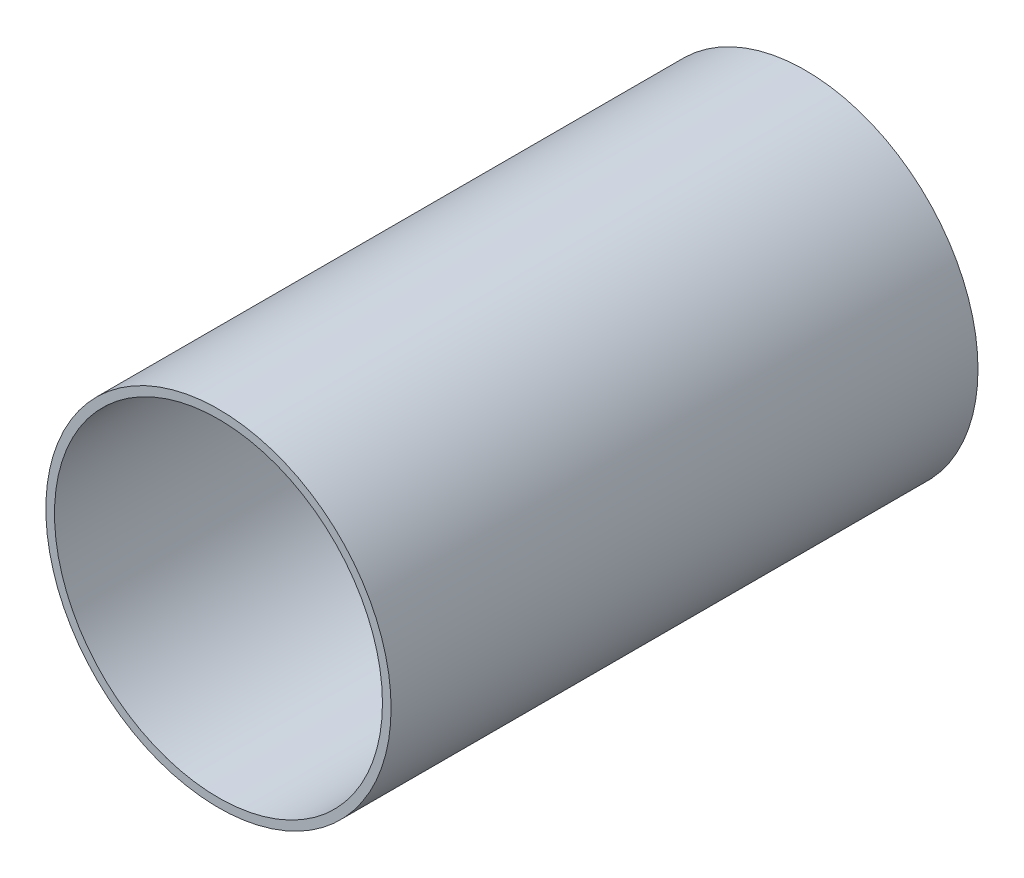
from build123d import *

# Parameters (mm, degrees)
SKETCH1_R           = 63.5
SKETCH1_R_2         = 60.325
BOSS_EXTRUDE1_DEPTH = 107.95


with BuildPart() as part:
    # Sketch1 → Boss-Extrude1 (new, symmetric)
    with BuildSketch(Plane.XY):
        Circle(SKETCH1_R)
        Circle(SKETCH1_R_2, mode=Mode.SUBTRACT)
    extrude(amount=BOSS_EXTRUDE1_DEPTH, both=True)


solid = part.part
